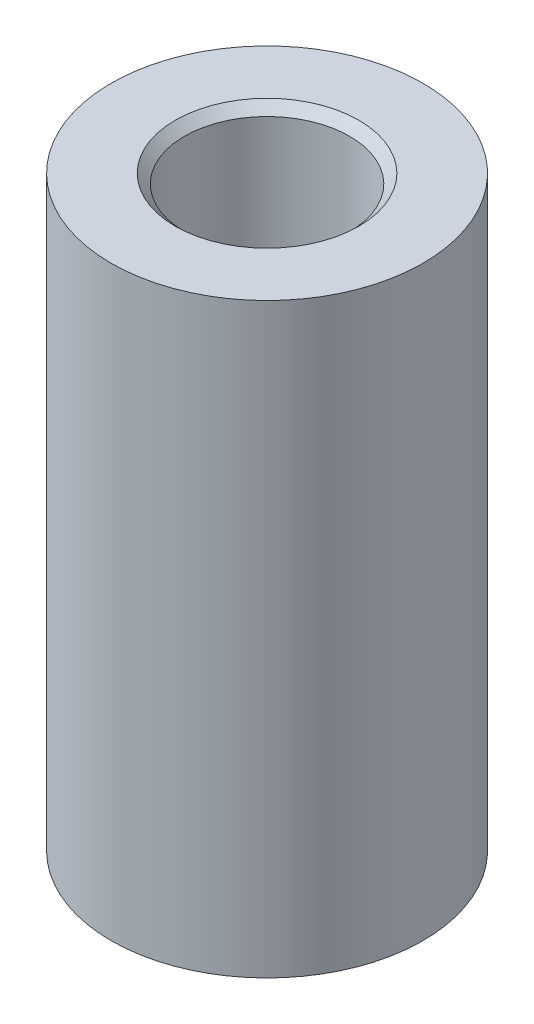
from build123d import *

# Parameters (mm, degrees)
SKETCH1_R           = 6.75
SKETCH1_R_2         = 3.575
BOSS_EXTRUDE1_DEPTH = 25.4
CHAMFER1_SIZE       = 0.4


with BuildPart() as part:
    # Sketch1 → Boss-Extrude1 (new body)
    with BuildSketch(Plane(origin=(0, 0, 0), x_dir=(1, 0, 0), z_dir=(0, 1, 0))):
        with Locations(Location((-839.144552427, 1451.423283645, 0), (0, 0, 270))):
            Circle(SKETCH1_R)
        with Locations(Location((-839.144552427, 1451.423283645, 0), (0, 0, 270))):
            Circle(SKETCH1_R_2, mode=Mode.SUBTRACT)
    extrude(amount=BOSS_EXTRUDE1_DEPTH)

    # Chamfer1
    chamfer1_edges = [part.edges().sort_by_distance(p)[0] for p in [
        (-839.144552427, 0, -1454.998283645),
        (-839.144552427, 25.4, -1454.998283645),
    ]]
    chamfer(chamfer1_edges, length=CHAMFER1_SIZE)


solid = part.part
